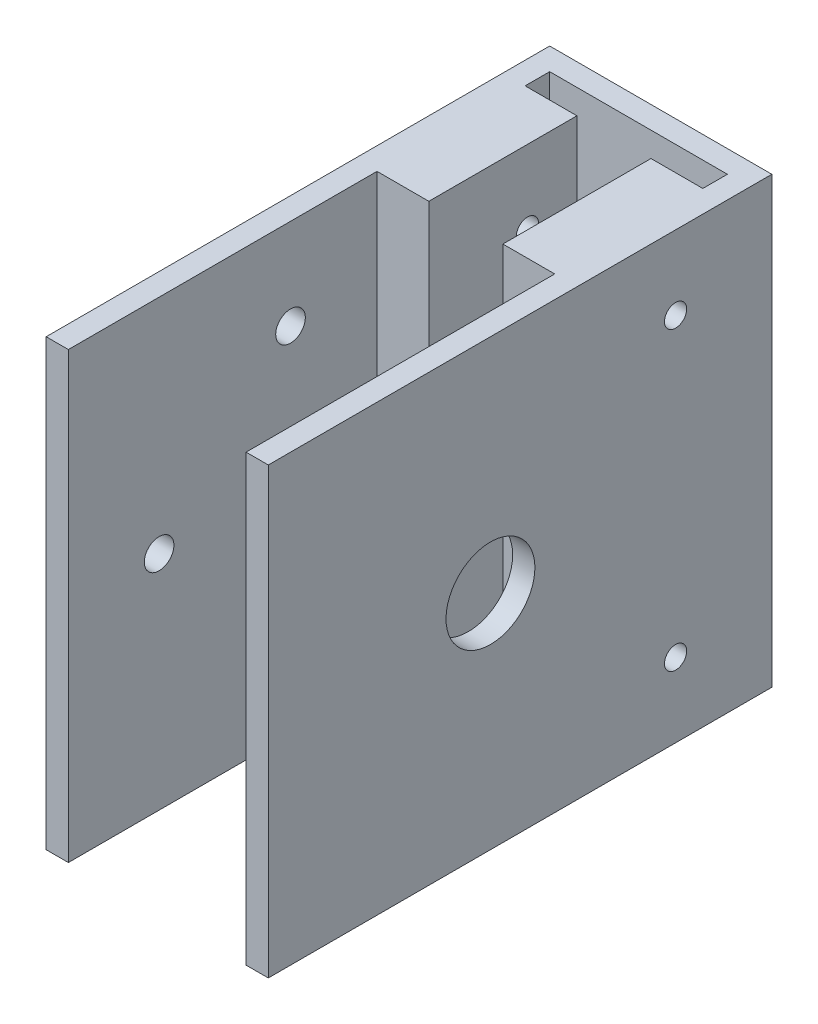
from build123d import *

# Parameters (mm, degrees)
SKETCH1_W               = 30
SKETCH1_H               = 60
SKETCH1_R               = 2.9
BOSS_EXTRUDE1_DEPTH     = 3
SKETCH2_W               = 3
SKETCH2_H               = 60
BOSS_EXTRUDE2_DEPTH     = 65
SKETCH5_W               = 7
SKETCH5_H               = 20
BOSS_EXTRUDE3_DEPTH     = 60
CUT_EXTRUDE1_REACH      = 82.15
SKETCH3_R               = 1.5
SKETCH3_R_2             = 6
SKETCH3_R_3             = 2
CUT_EXTRUDE2_DEPTH      = 80.075912894
CUT_EXTRUDE2_DEPTH_BACK = 80.075912894
SKETCH4_R               = 1.5
SKETCH4_R_2             = 6


with BuildPart() as part:
    # Sketch1 → Boss-Extrude1 (new body)
    with BuildSketch(Plane.XY):
        Rectangle(SKETCH1_W, SKETCH1_H)
        with Locations((0, 15)):
            Circle(SKETCH1_R, mode=Mode.SUBTRACT)
        with Locations(Location((0, -15, 0), (0, 0, 180))):
            Circle(SKETCH1_R, mode=Mode.SUBTRACT)
    extrude(amount=BOSS_EXTRUDE1_DEPTH)

    # Sketch2 → Boss-Extrude2 (add)
    with BuildSketch(Plane.XY.offset(3)):
        with Locations((-13.5, 0)):
            Rectangle(SKETCH2_W, SKETCH2_H)
        with Locations((13.5, 0)):
            Rectangle(SKETCH2_W, SKETCH2_H)
    extrude(amount=BOSS_EXTRUDE2_DEPTH)

    # Sketch5 → Boss-Extrude3 (add)
    with BuildSketch(Plane(origin=(0, 30, 0), x_dir=(1, 0, 0), z_dir=(0, 1, 0))):
        with Locations((8.5, -16.320138996)):
            Rectangle(SKETCH5_W, SKETCH5_H)
        with Locations((-8.5, -16.320138996)):
            Rectangle(SKETCH5_W, SKETCH5_H)
    extrude(amount=-BOSS_EXTRUDE3_DEPTH)

    # Sketch3 → Cut-Extrude1 (cut, up to next)
    with BuildSketch(Plane.ZY.offset(15), mode=Mode.PRIVATE) as cut_extrude1_sk1:
        with Locations(Location((13, 20, 0), (0, 0, 270))):
            Circle(SKETCH3_R)
    cut_extrude1_tool1 = extrude(cut_extrude1_sk1.sketch, amount=-CUT_EXTRUDE1_REACH, mode=Mode.PRIVATE) & part.part
    # Sketch3 → Cut-Extrude1 (cut, up to next)
    with BuildSketch(Plane.ZY.offset(15), mode=Mode.PRIVATE) as cut_extrude1_sk2:
        with Locations(Location((38, 0, 0), (0, 0, 270))):
            Circle(SKETCH3_R_2)
    cut_extrude1_tool2 = extrude(cut_extrude1_sk2.sketch, amount=-CUT_EXTRUDE1_REACH, mode=Mode.PRIVATE) & part.part
    # Sketch3 → Cut-Extrude1 (cut, up to next)
    with BuildSketch(Plane.ZY.offset(15), mode=Mode.PRIVATE) as cut_extrude1_sk3:
        with Locations(Location((20.25, 0, 0), (0, 0, 270))):
            Circle(SKETCH3_R_3)
    cut_extrude1_tool3 = extrude(cut_extrude1_sk3.sketch, amount=-CUT_EXTRUDE1_REACH, mode=Mode.PRIVATE) & part.part
    # Sketch3 → Cut-Extrude1 (cut, up to next)
    with BuildSketch(Plane.ZY.offset(15), mode=Mode.PRIVATE) as cut_extrude1_sk4:
        with Locations(Location((38, 17.75, 0), (0, 0, 270))):
            Circle(SKETCH3_R_3)
    cut_extrude1_tool4 = extrude(cut_extrude1_sk4.sketch, amount=-CUT_EXTRUDE1_REACH, mode=Mode.PRIVATE) & part.part
    # Sketch3 → Cut-Extrude1 (cut, up to next)
    with BuildSketch(Plane.ZY.offset(15), mode=Mode.PRIVATE) as cut_extrude1_sk5:
        with Locations(Location((55.75, 0, 0), (0, 0, 270))):
            Circle(SKETCH3_R_3)
    cut_extrude1_tool5 = extrude(cut_extrude1_sk5.sketch, amount=-CUT_EXTRUDE1_REACH, mode=Mode.PRIVATE) & part.part
    # Sketch3 → Cut-Extrude1 (cut, up to next)
    with BuildSketch(Plane.ZY.offset(15), mode=Mode.PRIVATE) as cut_extrude1_sk6:
        with Locations(Location((38, -17.75, 0), (0, 0, 270))):
            Circle(SKETCH3_R_3)
    cut_extrude1_tool6 = extrude(cut_extrude1_sk6.sketch, amount=-CUT_EXTRUDE1_REACH, mode=Mode.PRIVATE) & part.part
    # Sketch3 → Cut-Extrude1 (cut, up to next)
    with BuildSketch(Plane.ZY.offset(15), mode=Mode.PRIVATE) as cut_extrude1_sk7:
        with Locations((13, -20)):
            Circle(SKETCH3_R)
    cut_extrude1_tool7 = extrude(cut_extrude1_sk7.sketch, amount=-CUT_EXTRUDE1_REACH, mode=Mode.PRIVATE) & part.part
    add(cut_extrude1_tool1.solids().sort_by_distance((-15, 20, 13))[0], mode=Mode.SUBTRACT)
    add(cut_extrude1_tool2.solids().sort_by_distance((-15, 0, 38))[0], mode=Mode.SUBTRACT)
    add(cut_extrude1_tool3.solids().sort_by_distance((-15, 0, 20.25))[0], mode=Mode.SUBTRACT)
    add(cut_extrude1_tool4.solids().sort_by_distance((-15, 17.75, 38))[0], mode=Mode.SUBTRACT)
    add(cut_extrude1_tool5.solids().sort_by_distance((-15, 0, 55.75))[0], mode=Mode.SUBTRACT)
    add(cut_extrude1_tool6.solids().sort_by_distance((-15, -17.75, 38))[0], mode=Mode.SUBTRACT)
    add(cut_extrude1_tool7.solids().sort_by_distance((-15, -20, 13))[0], mode=Mode.SUBTRACT)

    # Sketch4 → Cut-Extrude2 (cut, two sides: drawn at the far end of the back side and taken through both)
    with BuildSketch(Plane.ZY.offset(-12).offset(-CUT_EXTRUDE2_DEPTH_BACK)):
        with Locations((13, -20)):
            Circle(SKETCH4_R)
        with Locations(Location((13, 20, 0), (0, 0, 270))):
            Circle(SKETCH4_R)
        with Locations(Location((38, 0, 0), (0, 0, 270))):
            Circle(SKETCH4_R_2)
    extrude(amount=CUT_EXTRUDE2_DEPTH + CUT_EXTRUDE2_DEPTH_BACK, mode=Mode.SUBTRACT)


solid = part.part
